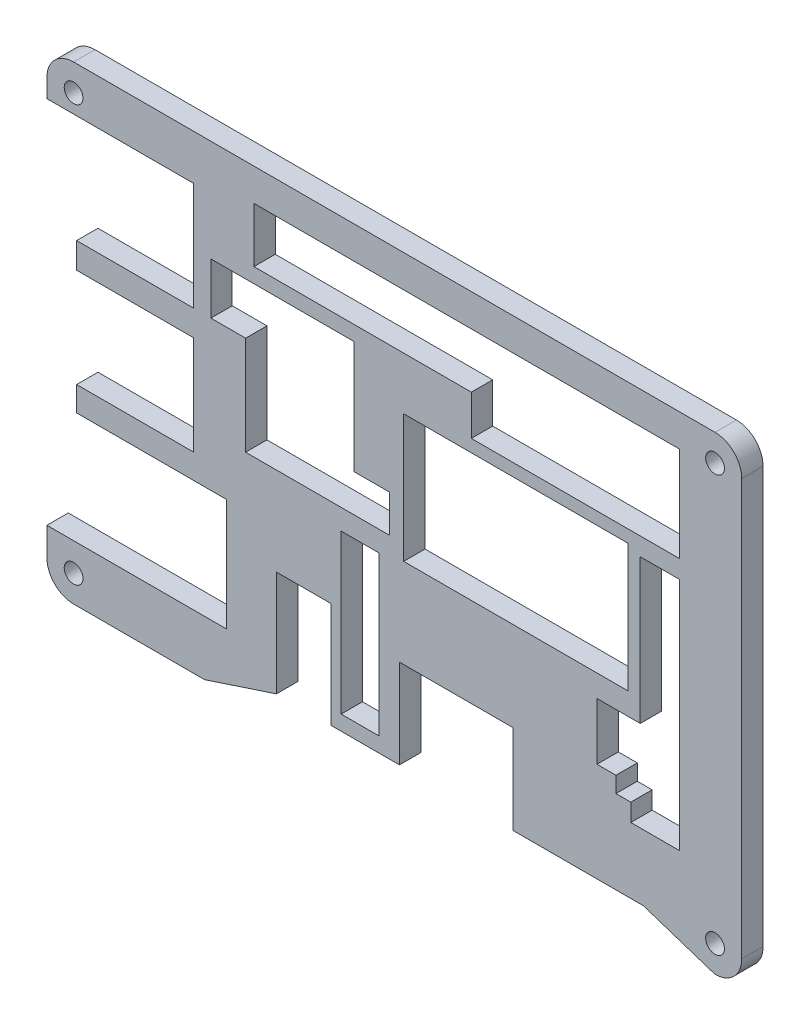
from build123d import *

# Parameters (mm, degrees)
SKETCH2_W           = 5.4034
SKETCH2_H           = 22.6066
SKETCH2_W_2         = 31.9679
SKETCH2_H_2         = 18.2371
BOSS_EXTRUDE1_DEPTH = 3.048
SKETCH3_R           = 1.338245378
CUT_EXTRUDE1_DEPTH  = 72.310891511


with BuildPart() as part:
    # Sketch2 → Boss-Extrude1 (new body)
    with BuildSketch(Plane(origin=(0, 0, 8.171752382), x_dir=(-1, 0, 0), z_dir=(0, 0, -1))):
        with BuildLine():
            Line((-23.844892625, -33.084405696), (-34.084892625, -36.451005696))
            ThreePointArc((-34.084892625, -36.451005696), (-36.778969461, -35.335082532), (-37.894892625, -32.641005696))
            Line((-37.894892625, -32.641005696), (-37.894892625, 26.697694304))
            ThreePointArc((-37.894892625, 26.697694304), (-36.778969461, 29.391771141), (-34.084892625, 30.507694304))
            Line((-34.084892625, 30.507694304), (57.404932375, 30.507694304))
            ThreePointArc((57.404932375, 30.507694304), (60.103884597, 29.386886916), (61.214907375, 26.683892153))
            Line((61.214907375, 26.683892153), (61.214907375, 24.068294304))
            Line((61.214907375, 24.068294304), (40.325007375, 24.068294304))
            Line((40.325007375, 24.068294304), (40.325007375, 8.658194304))
            Line((40.325007375, 8.658194304), (56.975007375, 8.658194304))
            Line((56.975007375, 8.658194304), (56.975007375, 4.997894304))
            Line((56.975007375, 4.997894304), (40.325007375, 4.997894304))
            Line((40.325007375, 4.997894304), (40.325007375, -9.121805696))
            Line((40.325007375, -9.121805696), (56.975007375, -9.121805696))
            Line((56.975007375, -9.121805696), (56.975007375, -12.628005696))
            Line((56.975007375, -12.628005696), (35.575007375, -12.628005696))
            Line((35.575007375, -12.628005696), (35.575007375, -28.627805696))
            Line((35.575007375, -28.627805696), (61.214907375, -28.627805696))
            Line((61.214907375, -28.627805696), (61.214907375, -32.613401529))
            ThreePointArc((61.214907375, -32.613401529), (60.108826144, -35.325305244), (57.405007375, -36.451005696))
            Line((57.405007375, -36.451005696), (38.714307375, -36.451005696))
            Line((38.714307375, -36.451005696), (28.474307375, -33.084405696))
            Line((28.474307375, -33.084405696), (28.474307375, -18.034905696))
            Line((28.474307375, -18.034905696), (20.658107375, -18.034905696))
            Line((20.658107375, -18.034905696), (20.658107375, -33.084405696))
            Line((20.658107375, -33.084405696), (10.926407375, -33.084405696))
            Line((10.926407375, -33.084405696), (10.926407375, -20.384405696))
            Line((10.926407375, -20.384405696), (-5.302892625, -20.384405696))
            Line((-5.302892625, -20.384405696), (-5.302892625, -33.084405696))
            Line((-5.302892625, -33.084405696), (-23.844892625, -33.084405696))
        make_face()
        with Locations((16.546707375, -19.663505696)):
            Rectangle(SKETCH2_W, SKETCH2_H, mode=Mode.SUBTRACT)
        Polygon((-29.004892625, -23.698905696), (-22.066892625, -23.698905696), (-22.066892625, -21.185805696), (-19.950892625, -21.185805696), (-19.950892625, -18.920605696), (-17.244692625, -18.920605696), (-17.244692625, -10.792605696), (-23.416892625, -10.792605696), (-23.416892625, 9.801194304), (-29.004892625, 9.801194304), align=None, mode=Mode.SUBTRACT)
        with Locations((-5.654942625, 1.475544304)):
            Rectangle(SKETCH2_W_2, SKETCH2_H_2, mode=Mode.SUBTRACT)
        Polygon((12.361007375, -0.097605696), (17.441007375, -0.097605696), (17.441007375, 15.972394304), (37.825007375, 15.972394304), (37.825007375, 8.658194304), (32.872007375, 8.658194304), (32.872007375, -5.431505696), (12.361007375, -5.431505696), align=None, mode=Mode.SUBTRACT)
        Polygon((0.677107375, 12.372094304), (-29.004794688, 12.372094304), (-29.004892625, 25.896994304), (31.688307375, 25.896994304), (31.688307375, 18.086994304), (0.677107375, 18.086994304), align=None, mode=Mode.SUBTRACT)
    extrude(amount=BOSS_EXTRUDE1_DEPTH)

    # Sketch3 → Cut-Extrude1 (cut, through all)
    with BuildSketch(Plane(origin=(0, 0, 5.123752382), x_dir=(-1, 0, 0), z_dir=(0, 0, -1))):
        with Locations((57.405007375, -32.641005696)):
            Circle(SKETCH3_R)
        with Locations((-34.084892625, -32.641005696)):
            Circle(SKETCH3_R)
        with Locations((-34.084892625, 26.697694304)):
            Circle(SKETCH3_R)
        with Locations((57.404932375, 26.697694304)):
            Circle(SKETCH3_R)
    extrude(amount=-CUT_EXTRUDE1_DEPTH, mode=Mode.SUBTRACT)


solid = part.part
